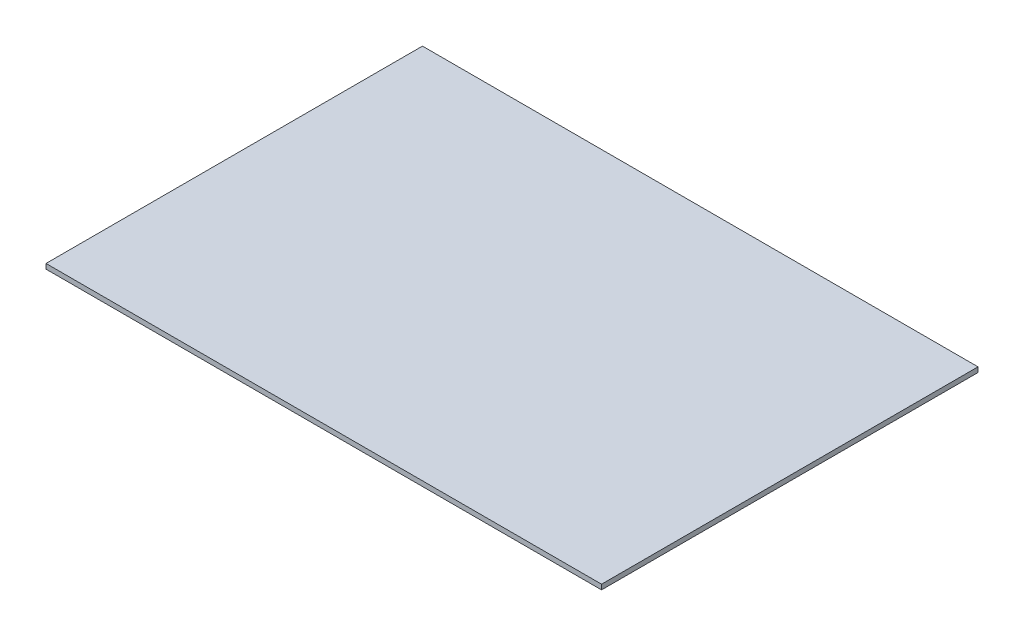
from build123d import *

# Parameters (mm, degrees)
SKETCH1_W           = 336
SKETCH1_H           = 227.69
BOSS_EXTRUDE1_DEPTH = 3


with BuildPart() as part:
    # Sketch1 → Boss-Extrude1 (new body)
    with BuildSketch(Plane(origin=(0, 0, 0), x_dir=(1, 0, 0), z_dir=(0, 1, 0))):
        with Locations((168, 113.845)):
            Rectangle(SKETCH1_W, SKETCH1_H)
    extrude(amount=BOSS_EXTRUDE1_DEPTH)


solid = part.part
